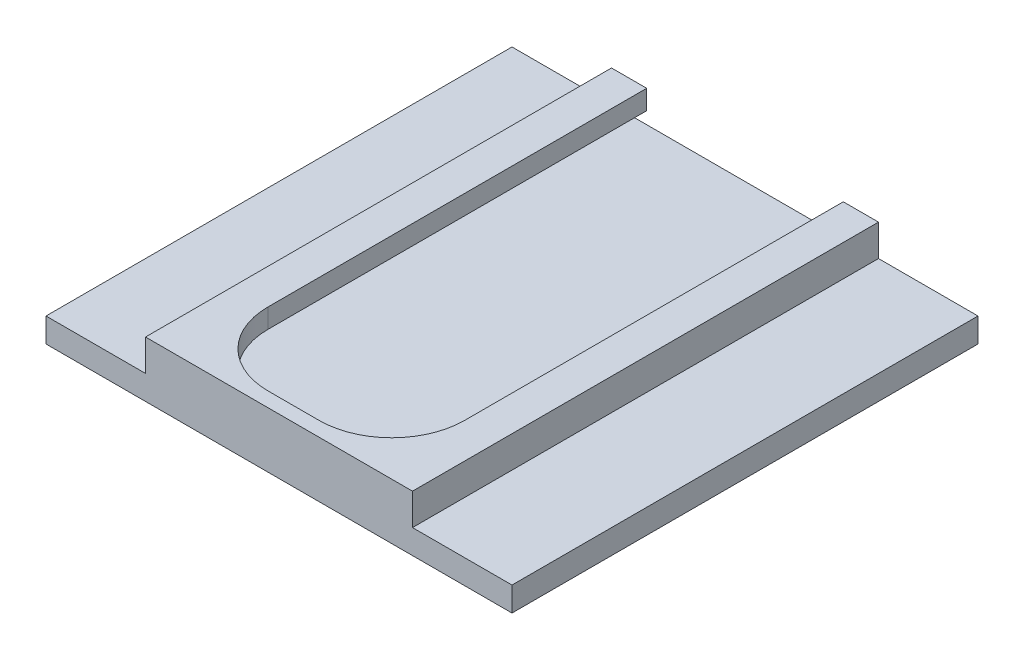
from build123d import *

# Parameters (mm, degrees)
SKETCH1_W           = 96
SKETCH1_H           = 96
SKETCH1_W_2         = 90
SKETCH1_H_2         = 90
BOSS_EXTRUDE1_DEPTH = 2
SKETCH1_3_W         = 96
SKETCH1_3_H         = 96
SKETCH1_3_W_2       = 90
SKETCH1_3_H_2       = 90
BOSS_EXTRUDE2_DEPTH = 3
BOSS_EXTRUDE3_DEPTH = 96
SKETCH3_3_W         = 40.5
SKETCH3_3_H         = 4
BOSS_EXTRUDE4_DEPTH = 3
FILLET1_R           = 15


with BuildPart() as part:
    # Sketch1 → Boss-Extrude1 (new body)
    # profile 1 of 2: a face of its own
    with BuildSketch(Plane(origin=(0, 0, 0), x_dir=(1, 0, 0), z_dir=(0, 1, 0))):
        Rectangle(SKETCH1_W, SKETCH1_H)
        Rectangle(SKETCH1_W_2, SKETCH1_H_2, mode=Mode.SUBTRACT)
    # profile 2 of 2: a face of its own
    with BuildSketch(Plane(origin=(0, 0, 0), x_dir=(1, 0, 0), z_dir=(0, 1, 0))):
        Rectangle(SKETCH1_W_2, SKETCH1_H_2)
    extrude(amount=BOSS_EXTRUDE1_DEPTH)

    # Sketch1<3> → Boss-Extrude2 (add)
    with BuildSketch(Plane(origin=(0, 0, 0), x_dir=(1, 0, 0), z_dir=(0, 1, 0))):
        Rectangle(SKETCH1_3_W, SKETCH1_3_H)
        Rectangle(SKETCH1_3_W_2, SKETCH1_3_H_2, mode=Mode.SUBTRACT)
    extrude(amount=-BOSS_EXTRUDE2_DEPTH)

    # Sketch3 → Boss-Extrude3 (add)
    with BuildSketch(Plane.XY.offset(48)):
        Polygon((-27.5, 8.5), (-27.5, 2), (-24.25, 2), (-24.25, 4.5), (-20.25, 4.5), (-20.25, 8.5), align=None)
        Polygon((24.25, 4.5), (24.25, 2), (27.5, 2), (27.5, 8.5), (20.25, 8.5), (20.25, 4.5), align=None)
    extrude(amount=-BOSS_EXTRUDE3_DEPTH)

    # Sketch3<3> → Boss-Extrude4 (add)
    with BuildSketch(Plane.XY.offset(48)):
        Polygon((-24.25, 4.5), (-24.25, 2), (24.25, 2), (24.25, 4.5), (20.25, 4.5), (-20.25, 4.5), align=None)
        with Locations((0, 6.5)):
            Rectangle(SKETCH3_3_W, SKETCH3_3_H)
    extrude(amount=-BOSS_EXTRUDE4_DEPTH)

    # Fillet1
    fillet1_edges = [part.edges().sort_by_distance(p)[0] for p in [
        (-20.25, 6.5, 45),
        (20.25, 6.5, 45),
    ]]
    fillet(fillet1_edges, radius=FILLET1_R)


solid = part.part
